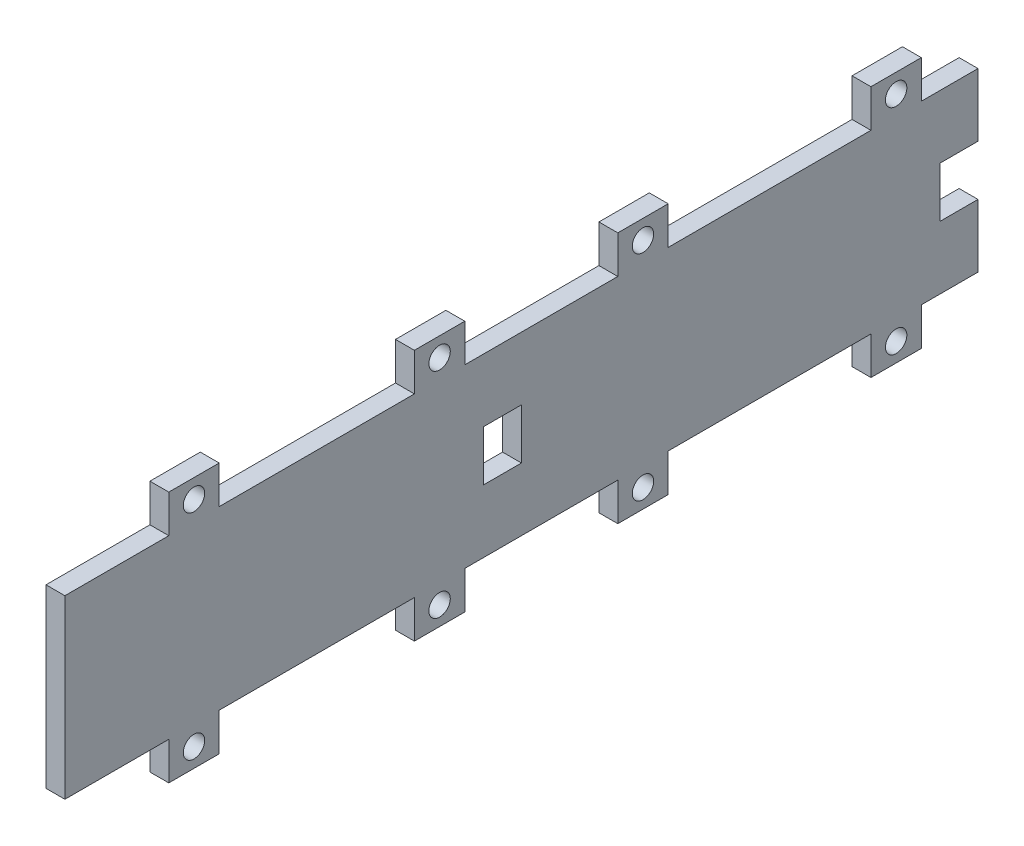
from build123d import *

# Parameters (mm, degrees)
EXTRUDE_START   = 20.5
SKETCH_1_R      = 1.7
SKETCH_1_W      = 6
SKETCH_1_H      = 8
EXTRUDE_1_DEPTH = 3


with BuildPart() as part:
    # 草圖1 → 填料-伸長1 (new body)
    with BuildSketch(Plane(origin=(0, 0, 0), x_dir=(0, 0, -1), z_dir=(1, 0, 0)).offset(EXTRUDE_START)):
        Polygon((-10.5, 14), (-19.5, 14), (-19.5, 20), (-27.5, 20), (-27.5, 14), (-59.7, 14), (-59.7, 20), (-67.7, 20), (-67.7, 14), (-92, 14), (-92, 20), (-100, 20), (-100, 14), (-131, 14), (-131, 20), (-139, 20), (-139, 14), (-155.5, 14), (-155.5, -14), (-139, -14), (-139, -20), (-131, -20), (-131, -14), (-100, -14), (-100, -20), (-92, -20), (-92, -14), (-67.7, -14), (-67.7, -20), (-59.7, -20), (-59.7, -14), (-27.5, -14), (-27.5, -20), (-19.5, -20), (-19.5, -14), (-10.5, -14), (-10.5, -4), (-16.5, -4), (-16.5, 4), (-10.5, 4), align=None)
        with Locations((-23.5, 17)):
            Circle(SKETCH_1_R, mode=Mode.SUBTRACT)
        with Locations((-23.5, -17)):
            Circle(SKETCH_1_R, mode=Mode.SUBTRACT)
        with Locations((-63.7, 17)):
            Circle(SKETCH_1_R, mode=Mode.SUBTRACT)
        with Locations((-63.7, -17)):
            Circle(SKETCH_1_R, mode=Mode.SUBTRACT)
        with Locations((-96, 17)):
            Circle(SKETCH_1_R, mode=Mode.SUBTRACT)
        with Locations((-96, -17)):
            Circle(SKETCH_1_R, mode=Mode.SUBTRACT)
        with Locations((-135, 17)):
            Circle(SKETCH_1_R, mode=Mode.SUBTRACT)
        with Locations((-135, -17)):
            Circle(SKETCH_1_R, mode=Mode.SUBTRACT)
        with Locations((-86, 0)):
            Rectangle(SKETCH_1_W, SKETCH_1_H, mode=Mode.SUBTRACT)
    extrude(amount=EXTRUDE_1_DEPTH)


solid = part.part
